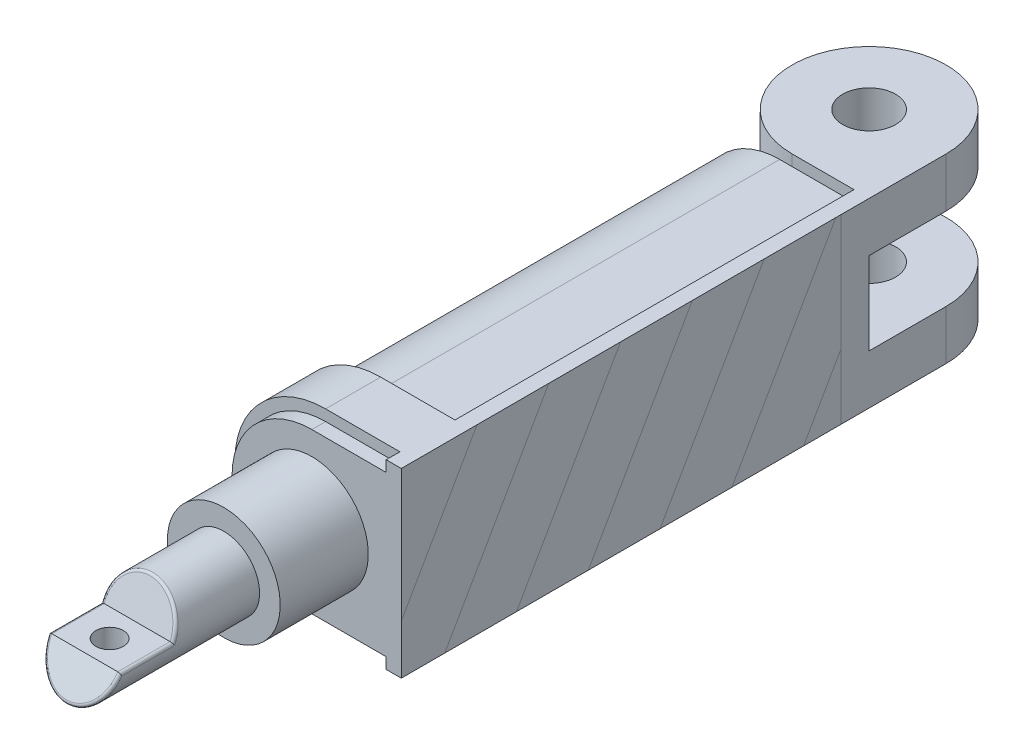
from build123d import *

# Parameters (mm, degrees)
SKETCH_1_R               = 2.4
EXTRUDE_1_DEPTH          = 16.5
EXTRUDE_2_DEPTH          = 42.5
EXTRUDE_START            = -6.25
EXTRUDE_3_DEPTH          = 5
CUT_EXTRUDE_1_DEPTH      = 100.173616703
CUT_EXTRUDE_1_DEPTH_BACK = 100.173616703
CUT_EXTRUDE_2_DEPTH      = 86.750911074
CUT_EXTRUDE_2_DEPTH_BACK = 86.750911074
SKETCH_7_R               = 1.25
FILLET_1_R               = 0.25
CUT_EXTRUDE_3_DEPTH      = 100.072557411
CUT_EXTRUDE_3_DEPTH_BACK = 100.072557411


with BuildPart() as part:
    # 草图1 → 凸台-拉伸1 (new body)
    with BuildSketch(Plane(origin=(0, -50.5, 0), x_dir=(1, 0, 0), z_dir=(0, 1, 0))):
        with BuildLine():
            ThreePointArc((65.375, 17.125), (53.425252532, 22.074747468), (58.375, 10.125))
            Line((58.375, 10.125), (65.375, 10.125))
            Line((65.375, 10.125), (65.375, 17.125))
        make_face()
        with Locations((58.375, 17.125)):
            Circle(SKETCH_1_R, mode=Mode.SUBTRACT)
    extrude(amount=EXTRUDE_1_DEPTH)

    # 草图2 → 凸台-拉伸2 (add)
    with BuildSketch(Plane.XY.offset(-10.125)):
        with BuildLine():
            Line((64, -50.5), (65.375, -50.5))
            Line((65.375, -50.5), (65.375, -34))
            Line((65.375, -34), (64, -34))
            Line((64, -34), (64, -35))
            Line((64, -35), (57.25, -35))
            ThreePointArc((57.25, -35), (50, -42.25), (57.25, -49.5))
            Line((57.25, -49.5), (64, -49.5))
            Line((64, -49.5), (64, -50.5))
        make_face()
    extrude(amount=EXTRUDE_2_DEPTH)

    # 草图3 → 凸台-拉伸3 (add)
    with BuildSketch(Plane.XY.offset(32.375).offset(EXTRUDE_START)):
        with BuildLine():
            ThreePointArc((57.25, -49.5), (50, -42.25), (57.25, -35))
            Line((57.25, -35), (65.375, -35))
            Line((65.375, -35), (65.375, -34))
            Line((65.375, -34), (57.25, -34))
            ThreePointArc((57.25, -34), (49, -42.25), (57.25, -50.5))
            Line((57.25, -50.5), (65.375, -50.5))
            Line((65.375, -50.5), (65.375, -49.5))
            Line((65.375, -49.5), (57.25, -49.5))
        make_face()
    extrude(amount=EXTRUDE_3_DEPTH)

    # 草图5 → 旋转1 (revolve)
    with BuildSketch(Plane(origin=(0, -42.25, 0), x_dir=(1, 0, 0), z_dir=(0, 1, 0))):
        Polygon((62.375, -32.375), (57.25, -32.375), (57.25, -54.875), (60.5, -54.875), (60.5, -40.375), (62.375, -40.375), align=None)
    revolve(axis=Axis((57.25, -42.25, 32.375), (0, 0, 1)))

    # 草图6 → 切除-拉伸1 (cut, two sides: drawn at the far end of the back side and taken through both)
    with BuildSketch(Plane(origin=(0, 0, 0), x_dir=(0, 0, -1), z_dir=(1, 0, 0)).offset(-CUT_EXTRUDE_1_DEPTH_BACK)):
        Polygon((-48.25, -42.25), (-47, -39), (-54.875, -39), (-54.875, -45.5), (-53, -42.25), align=None)
    extrude(amount=CUT_EXTRUDE_1_DEPTH + CUT_EXTRUDE_1_DEPTH_BACK, mode=Mode.SUBTRACT)

    # 草图7 → 切除-拉伸2 (cut, two sides: drawn at the far end of the back side and taken through both)
    with BuildSketch(Plane(origin=(0, -42.25, 0), x_dir=(1, 0, 0), z_dir=(0, 1, 0)).offset(-CUT_EXTRUDE_2_DEPTH_BACK)):
        with Locations((57.25, -50.75)):
            Circle(SKETCH_7_R)
    extrude(amount=CUT_EXTRUDE_2_DEPTH + CUT_EXTRUDE_2_DEPTH_BACK, mode=Mode.SUBTRACT)

    # 圆角1
    fillet_1_edges = [part.edges().sort_by_distance(p)[0] for p in [
        (59.628523426, -44.464751975, 54.277741524),
        (54, -42.25, 50.625),
        (60.5, -42.25, 50.625),
        (59.587314609, -39.99180151, 47.381462119),
    ]]
    fillet(fillet_1_edges, radius=FILLET_1_R)

    # 草图8 → 切除-拉伸3 (cut, two sides: drawn at the far end of the back side and taken through both)
    with BuildSketch(Plane(origin=(0, 0, 0), x_dir=(0, 0, -1), z_dir=(1, 0, 0)).offset(-CUT_EXTRUDE_3_DEPTH_BACK)):
        Polygon((25.79116453, -38.5), (10.125, -38.5), (10.125, -46), (25.79116453, -46), (25.79116453, -42.25), align=None)
    extrude(amount=CUT_EXTRUDE_3_DEPTH + CUT_EXTRUDE_3_DEPTH_BACK, mode=Mode.SUBTRACT)


solid = part.part
